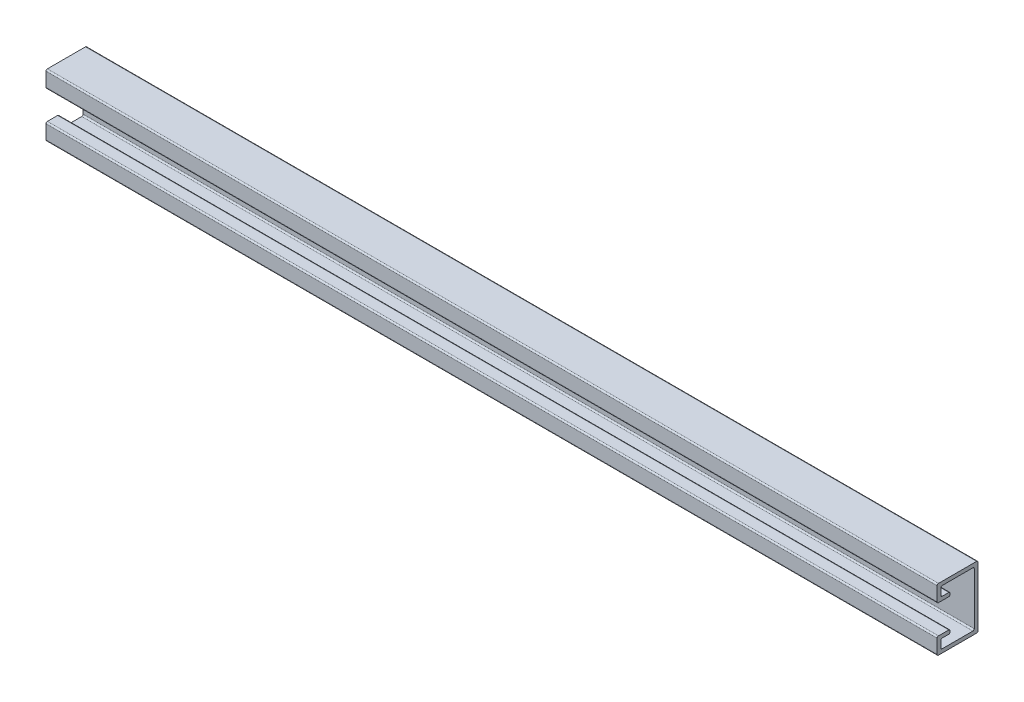
from build123d import *

# Parameters (mm, degrees)
EXTRUDE_THIN1_DEPTH = 1219.2
FILLET1_R           = 1.905


with BuildPart() as part:
    # Sketch1 → Extrude-Thin1 (new body)
    with BuildSketch(Plane(origin=(0, 0, 0), x_dir=(0, 0, -1), z_dir=(1, 0, 0))):
        Polygon((-33.02, 12.7), (-45.72, 12.7), (-45.72, 0), (0, 0), (0, 74.93), (-45.72, 74.93), (-45.72, 62.23), (-33.02, 62.23), (-33.02, 57.15), (-50.8, 57.15), (-50.8, 80.01), (5.08, 80.01), (5.08, -5.08), (-50.8, -5.08), (-50.8, 17.78), (-33.02, 17.78), align=None)
    extrude(amount=EXTRUDE_THIN1_DEPTH)

    # Fillet1
    fillet1_edges = [part.edges().sort_by_distance(p)[0] for p in [
        (609.6, 12.7, 45.72),
        (609.6, 0, 45.72),
        (609.6, 0, 0),
        (609.6, 74.93, 0),
        (609.6, 74.93, 45.72),
        (609.6, 62.23, 45.72),
        (609.6, 62.23, 33.02),
        (609.6, 57.15, 33.02),
        (609.6, 57.15, 50.8),
        (609.6, 80.01, 50.8),
        (609.6, 80.01, -5.08),
        (609.6, -5.08, -5.08),
        (609.6, -5.08, 50.8),
        (609.6, 17.78, 50.8),
        (609.6, 17.78, 33.02),
        (609.6, 12.7, 33.02),
    ]]
    fillet(fillet1_edges, radius=FILLET1_R)


solid = part.part
